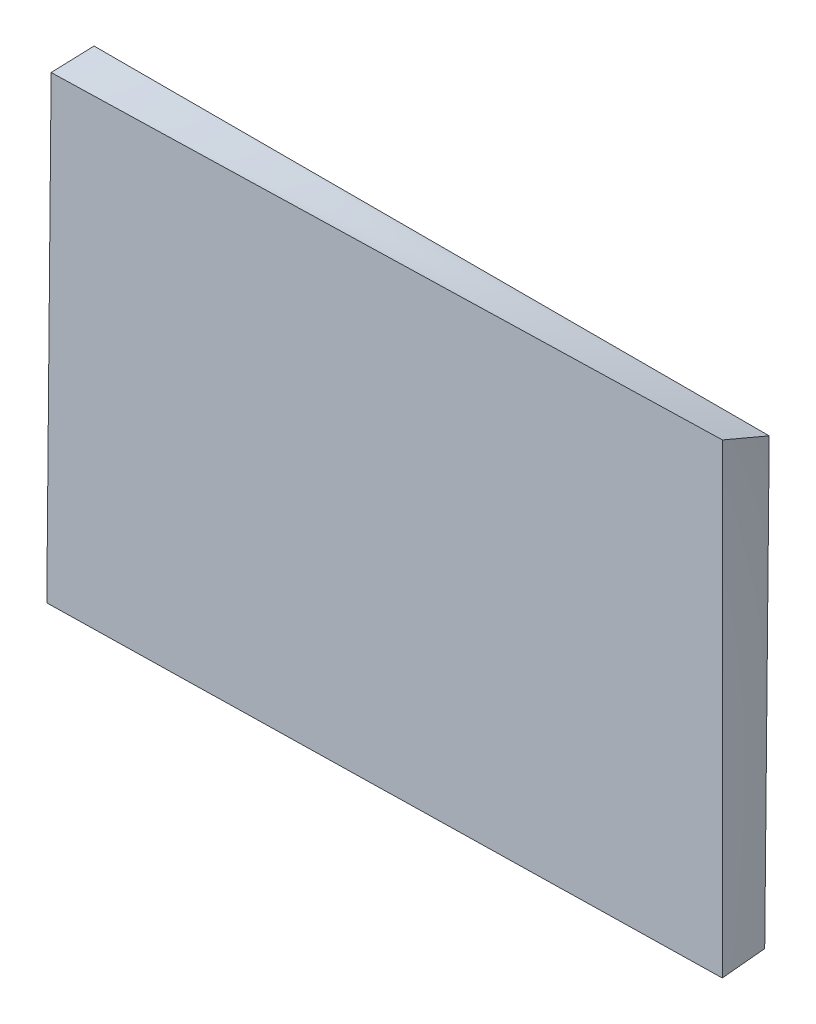
from build123d import *


with BuildPart() as part:
    # Skizze1 → Ausformung2 section 0
    with BuildSketch(Plane.XY):
        with BuildLine():
            Line((-14.999831078, 9.999747037), (-14.999831078, -10.100252963))
            Line((-14.999831078, -10.100252963), (14.899493233, -9.89924111))
            Line((14.899493233, -9.89924111), (15.100168922, 9.999747037))
            Line((15.100168922, 9.999747037), (-14.999831078, 9.999747037))
        make_face()
    # Skizze2 → Ausformung2 section 1
    with BuildSketch(Plane(origin=(0, 0.069798993, 1.998781654), x_dir=(-1, 0, 0), z_dir=(0, -0.03489949670250451, -0.9993908270190957))):
        with BuildLine():
            Line((15.248817676, 9.619512457), (14.748600157, -10.274199676))
            Line((14.748600157, -10.274199676), (-15.34623551, -9.7166459))
            Line((-15.34623551, -9.7166459), (-14.651182324, 10.371333119))
            Line((-14.651182324, 10.371333119), (15.248817676, 9.619512457))
        make_face()
    loft()


solid = part.part
